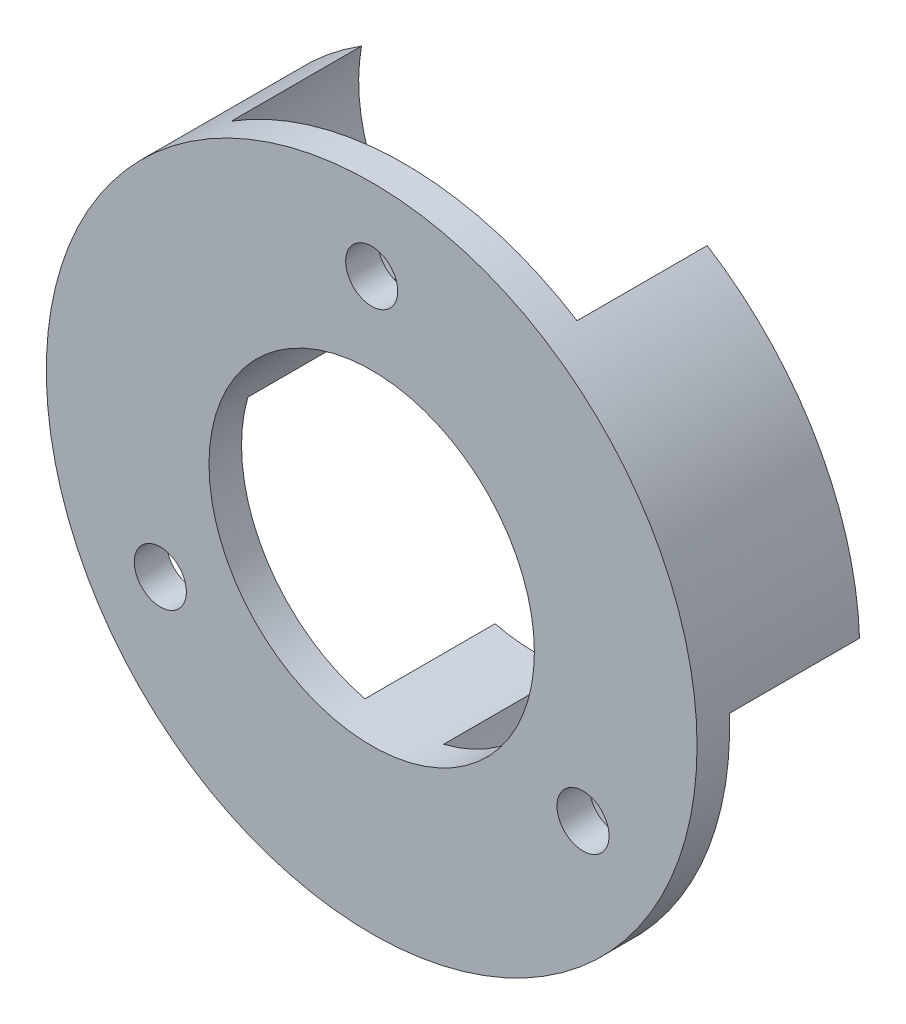
from build123d import *
from build123d.topology import SkipClean

# Parameters (mm, degrees)
SKETCH1_R           = 25
BOSS_EXTRUDE1_DEPTH = 2.5
BOSS_EXTRUDE2_START = 10
BOSS_EXTRUDE2_DEPTH = 10
SKETCH4_R           = 12.5
CUT_EXTRUDE1_DEPTH  = 8.2
SKETCH6_R           = 2
CUT_EXTRUDE3_DEPTH  = 6
SKETCH8_R           = 2
CUT_EXTRUDE4_DEPTH  = 6


with BuildPart() as part:
    # Sketch1 → Boss-Extrude1 (new body)
    with BuildSketch(Plane.XY):
        Circle(SKETCH1_R)
    extrude(amount=BOSS_EXTRUDE1_DEPTH)

    # Sketch3 → Boss-Extrude2 (add)
    with SkipClean():  # the faces are left unmerged after this step: merging them gives an invalid solid
        with BuildSketch(Plane(origin=(0, 0, 0), x_dir=(-1, 0, 0), z_dir=(0, 0, -1)).offset(BOSS_EXTRUDE2_START)):
            with BuildLine():
                ThreePointArc((-3.021915591, -12.129221993), (-6.060912506, -18.245026612), (-11.704264354, -22.090952807))
                ThreePointArc((-11.704264354, -22.090952807), (0, -25), (11.704264354, -22.090952807))
                ThreePointArc((11.704264354, -22.090952807), (6.060912506, -18.245026612), (3.021915591, -12.129221993))
                ThreePointArc((3.021915591, -12.129221993), (0, -12.5), (-3.021915591, -12.129221993))
            make_face()
            with BuildLine():
                ThreePointArc((-24.983458502, 0.909286141), (-18.831112792, 3.873609106), (-12.01517217, 3.447555327))
                ThreePointArc((-12.01517217, 3.447555327), (-10.825317547, 6.25), (-8.993256579, 8.681666667))
                ThreePointArc((-8.993256579, 8.681666667), (-12.770200286, 14.371417506), (-13.279194148, 21.181666667))
                ThreePointArc((-13.279194148, 21.181666667), (-21.650635095, 12.5), (-24.983458502, 0.909286141))
            make_face()
            with BuildLine():
                ThreePointArc((12.01517217, 3.447555327), (18.831112792, 3.873609106), (24.983458502, 0.909286141))
                ThreePointArc((24.983458502, 0.909286141), (21.650635095, 12.5), (13.279194148, 21.181666667))
                ThreePointArc((13.279194148, 21.181666667), (12.770200286, 14.371417506), (8.993256579, 8.681666667))
                ThreePointArc((8.993256579, 8.681666667), (10.825317547, 6.25), (12.01517217, 3.447555327))
            make_face()
        extrude(amount=-BOSS_EXTRUDE2_DEPTH)

    # Sketch4 → Cut-Extrude1 (cut)
    with SkipClean():  # the faces are left unmerged after this step: merging them gives an invalid solid
        with BuildSketch(Plane(origin=(0, 0, 0), x_dir=(-1, 0, 0), z_dir=(0, 0, -1))):
            with Locations(Location((0, 0, 0), (0, 0, 180))):
                Circle(SKETCH4_R)
        extrude(amount=-CUT_EXTRUDE1_DEPTH, mode=Mode.SUBTRACT)

    # Sketch6 → Cut-Extrude3 (cut)
    with SkipClean():  # the faces are left unmerged after this step: merging them gives an invalid solid
        with BuildSketch(Plane(origin=(0, 0, -10), x_dir=(-1, 0, 0), z_dir=(0, 0, -1))):
            with Locations((16.237976321, 9.375)):
                Circle(SKETCH6_R)
            with Locations((0, -18.75)):
                Circle(SKETCH6_R)
            with Locations((-16.237976321, 9.375)):
                Circle(SKETCH6_R)
        extrude(amount=-CUT_EXTRUDE3_DEPTH, mode=Mode.SUBTRACT)

    # Sketch8 → Cut-Extrude4 (cut)
    with SkipClean():  # the faces are left unmerged after this step: merging them gives an invalid solid
        with BuildSketch(Plane(origin=(0, 0, 0), x_dir=(-1, 0, 0), z_dir=(0, 0, -1))):
            with Locations((-16.237976321, -9.375)):
                Circle(SKETCH8_R)
            with Locations((0, 18.75)):
                Circle(SKETCH8_R)
            with Locations((16.237976321, -9.375)):
                Circle(SKETCH8_R)
        extrude(amount=-CUT_EXTRUDE4_DEPTH, mode=Mode.SUBTRACT)


solid = part.part
